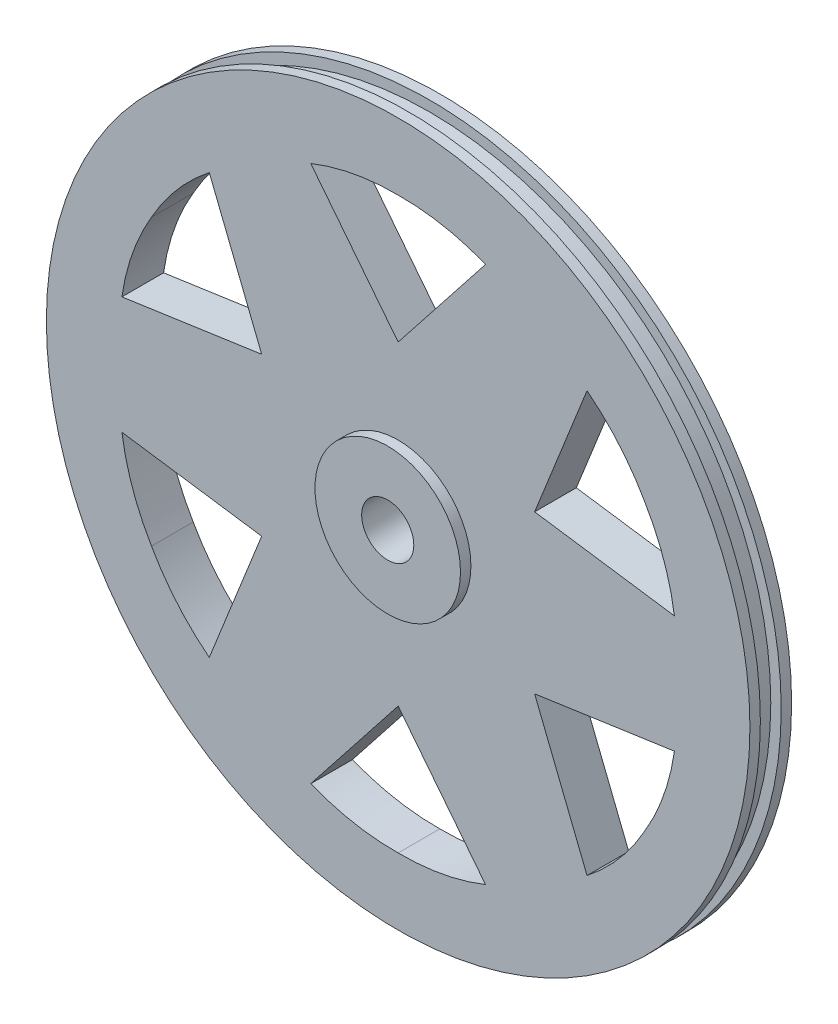
from build123d import *

# Parameters (mm, degrees)
SKETCH1_R           = 67.5
SKETCH1_R_2         = 5
BOSS_EXTRUDE1_DEPTH = 4
CUT_EXTRUDE1_DEPTH  = 4
CIRPATTERN1_COUNT   = 6
SKETCH3_R           = 67.5
SKETCH3_R_2         = 65.5
CUT_EXTRUDE2_DEPTH  = 2
SKETCH4_R           = 13.962380749
SKETCH4_R_2         = 5
BOSS_EXTRUDE2_DEPTH = 2


with BuildPart() as part:
    # Sketch1 → Boss-Extrude1 (new, symmetric)
    with BuildSketch(Plane.XY):
        Circle(SKETCH1_R)
        Circle(SKETCH1_R_2, mode=Mode.SUBTRACT)
    extrude(amount=BOSS_EXTRUDE1_DEPTH, both=True)

    # Sketch2 → Cut-Extrude1 (cut, symmetric)
    with BuildSketch(Plane.XY):
        with BuildLine():
            Line((0, 30.239217172), (-16.768164039, 51.529133311))
            ThreePointArc((-16.768164039, 51.529133311), (-8.53840593, 53.919450475), (0, 54.653043584))
            ThreePointArc((0, 54.653043584), (8.53840593, 53.919450475), (16.768164039, 51.529133311))
            Line((16.768164039, 51.529133311), (0, 30.239217172))
        make_face()
    cut_extrude1 = extrude(amount=CUT_EXTRUDE1_DEPTH, both=True, mode=Mode.SUBTRACT)

    # CirPattern1: Cut-Extrude1 ×6 about axis
    cirpattern1_axis = Axis((0, 0, 0), (0, 0, 1))
    for i in range(1, CIRPATTERN1_COUNT):
        add(cut_extrude1.rotate(cirpattern1_axis, i * 360 / CIRPATTERN1_COUNT), mode=Mode.SUBTRACT)

    # Sketch3 → Cut-Extrude2 (cut, symmetric)
    with BuildSketch(Plane.XY):
        Circle(SKETCH3_R)
        Circle(SKETCH3_R_2, mode=Mode.SUBTRACT)
    extrude(amount=CUT_EXTRUDE2_DEPTH, both=True, mode=Mode.SUBTRACT)

    # Sketch4 → Boss-Extrude2 (add)
    with BuildSketch(Plane.XY.offset(4)):
        Circle(SKETCH4_R)
        Circle(SKETCH4_R_2, mode=Mode.SUBTRACT)
    extrude(amount=BOSS_EXTRUDE2_DEPTH)


solid = part.part
